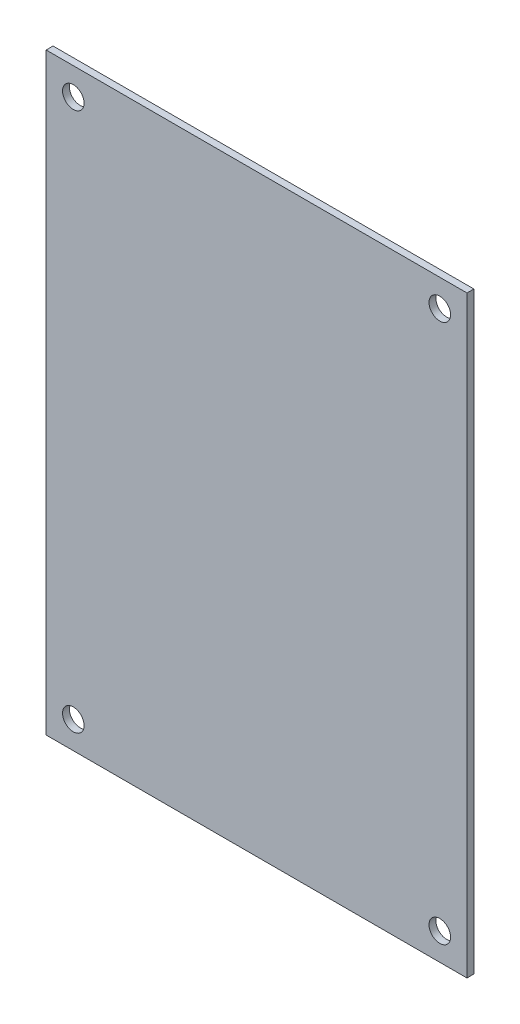
from build123d import *

# Parameters (mm, degrees)
BOSS_EXTRUDE1_DEPTH      = 1.016
BOSS_EXTRUDE1_DEPTH_BACK = 1.016
SKETCH3_W                = 123.952
SKETCH3_H                = 174.752
SKETCH3_R                = 3.175


with BuildPart() as part:
    # Sketch3 → Boss-Extrude1 (new, two sides: drawn at the far end of the back side and taken through both)
    with BuildSketch(Plane.XY.offset(-BOSS_EXTRUDE1_DEPTH_BACK)):
        Rectangle(SKETCH3_W, SKETCH3_H)
        with Locations((-53.975, 79.375)):
            Circle(SKETCH3_R, mode=Mode.SUBTRACT)
        with Locations((53.975, 79.375)):
            Circle(SKETCH3_R, mode=Mode.SUBTRACT)
        with Locations((-53.975, -79.375)):
            Circle(SKETCH3_R, mode=Mode.SUBTRACT)
        with Locations((53.975, -79.375)):
            Circle(SKETCH3_R, mode=Mode.SUBTRACT)
    extrude(amount=BOSS_EXTRUDE1_DEPTH + BOSS_EXTRUDE1_DEPTH_BACK)


solid = part.part
